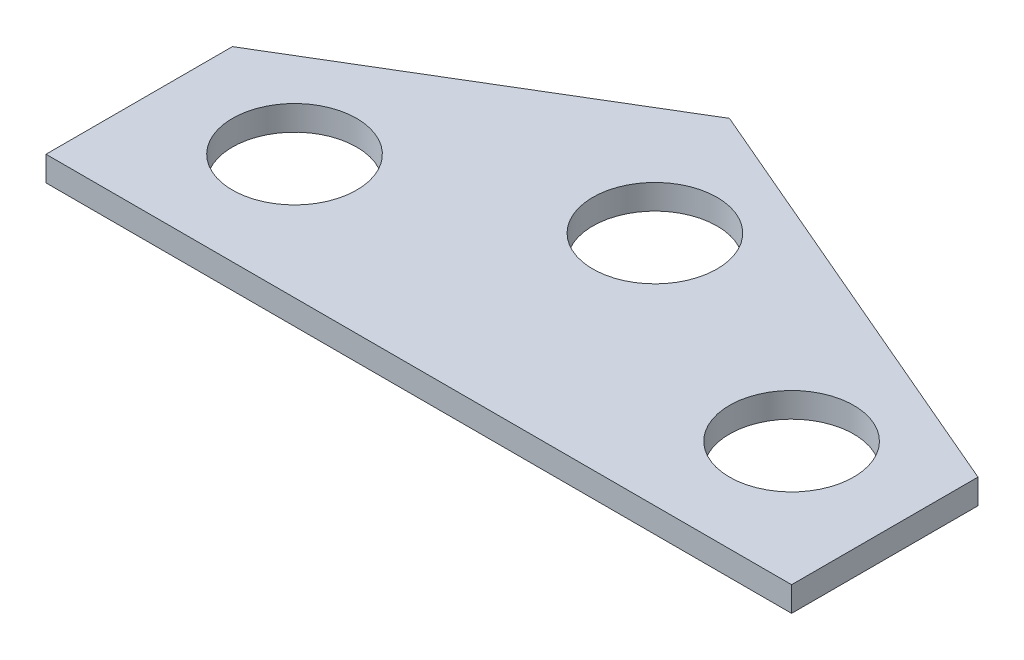
from build123d import *

# Parameters (mm, degrees)
SKETCH1_W           = 60
SKETCH1_H           = 30
BOSS_EXTRUDE1_DEPTH = 2
CUT_EXTRUDE1_DEPTH  = 68.111846942
SKETCH3_R           = 5
CUT_EXTRUDE2_DEPTH  = 68.111846942


with BuildPart() as part:
    # Sketch1 → Boss-Extrude1 (new body)
    with BuildSketch(Plane(origin=(0, 0, 0), x_dir=(1, 0, 0), z_dir=(0, 1, 0))):
        with Locations((30, 15)):
            Rectangle(SKETCH1_W, SKETCH1_H)
    extrude(amount=BOSS_EXTRUDE1_DEPTH)

    # Sketch2 → Cut-Extrude1 (cut, through all)
    with BuildSketch(Plane(origin=(0, 2, 0), x_dir=(1, 0, 0), z_dir=(0, 1, 0))):
        Polygon((60, 15), (60, 30), (25, 30), align=None)
        Polygon((0, 15), (25, 30), (0, 30), align=None)
    extrude(amount=-CUT_EXTRUDE1_DEPTH, mode=Mode.SUBTRACT)

    # Sketch3 → Cut-Extrude2 (cut, through all)
    with BuildSketch(Plane.XZ):
        with Locations(Location((10, -10, 0), (0, 0, 270))):
            Circle(SKETCH3_R)
        with Locations(Location((50, -10, 0), (0, 0, 90))):
            Circle(SKETCH3_R)
        with Locations(Location((30, -19, 0), (0, 0, 270))):
            Circle(SKETCH3_R)
    extrude(amount=-CUT_EXTRUDE2_DEPTH, mode=Mode.SUBTRACT)


solid = part.part
